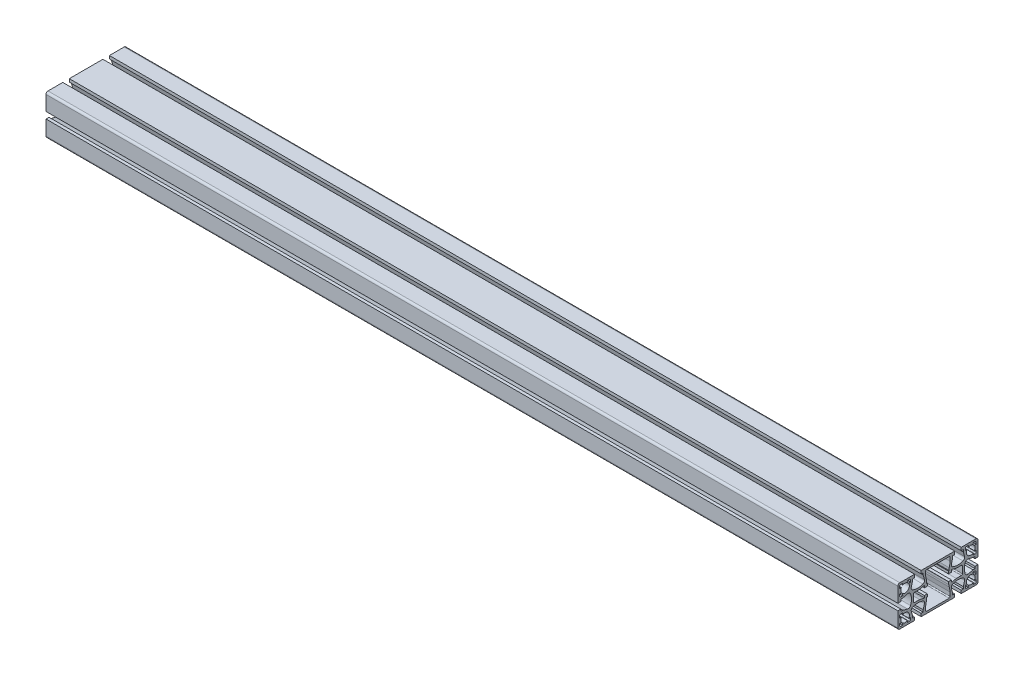
from build123d import *

# Parameters (mm, degrees)
MEMBER_1_DEPTH = 850


with BuildPart() as part:
    # Sketch11 → Member 1 (new body)
    with BuildSketch(Plane.YZ.offset(-425)):
        with BuildLine():
            Line((6.557907576, -30.305165676), (5.3, -34.999740661))
            Line((5.3, -34.999740661), (5.3, -37))
            Line((5.3, -37), (3.25, -37))
            Line((3.25, -37), (3.25, -40))
            Line((3.25, -40), (18, -40))
            ThreePointArc((18, -40), (19.414213562, -39.414213562), (20, -38))
            Line((20, -38), (20, -23.25))
            Line((20, -23.25), (17, -23.25))
            Line((17, -23.25), (17, -25.3))
            Line((17, -25.3), (14.999740661, -25.3))
            Line((14.999740661, -25.3), (10.305165676, -26.557907576))
            ThreePointArc((10.305165676, -26.557907576), (8.518070078, -26.368017861), (7.320109103, -25.028369294))
            ThreePointArc((7.320109103, -25.028369294), (6.4, -20), (7.320109103, -14.971630706))
            ThreePointArc((7.320109103, -14.971630706), (8.518070078, -13.631982139), (10.305165676, -13.442092424))
            Line((10.305165676, -13.442092424), (14.999740661, -14.7))
            Line((14.999740661, -14.7), (17, -14.7))
            Line((17, -14.7), (17, -16.75))
            Line((17, -16.75), (20, -16.75))
            Line((20, -16.75), (20, 16.75))
            Line((20, 16.75), (17, 16.75))
            Line((17, 16.75), (17, 14.7))
            Line((17, 14.7), (14.999740661, 14.7))
            Line((14.999740661, 14.7), (10.305165676, 13.442092424))
            ThreePointArc((10.305165676, 13.442092424), (8.518070078, 13.631982139), (7.320109103, 14.971630706))
            ThreePointArc((7.320109103, 14.971630706), (6.4, 20), (7.320109103, 25.028369294))
            ThreePointArc((7.320109103, 25.028369294), (8.518070078, 26.368017861), (10.305165676, 26.557907576))
            Line((10.305165676, 26.557907576), (14.999740661, 25.3))
            Line((14.999740661, 25.3), (17, 25.3))
            Line((17, 25.3), (17, 23.25))
            Line((17, 23.25), (20, 23.25))
            Line((20, 23.25), (20, 38))
            ThreePointArc((20, 38), (19.414213562, 39.414213562), (18, 40))
            Line((18, 40), (3.25, 40))
            Line((3.25, 40), (3.25, 37))
            Line((3.25, 37), (5.3, 37))
            Line((5.3, 37), (5.3, 34.999740661))
            Line((5.3, 34.999740661), (6.557907576, 30.305165676))
            ThreePointArc((6.557907576, 30.305165676), (6.368017861, 28.518070078), (5.028369294, 27.320109103))
            ThreePointArc((5.028369294, 27.320109103), (0, 26.4), (-5.028369294, 27.320109103))
            ThreePointArc((-5.028369294, 27.320109103), (-6.368017861, 28.518070078), (-6.557907576, 30.305165676))
            Line((-6.557907576, 30.305165676), (-5.3, 34.999740661))
            Line((-5.3, 34.999740661), (-5.3, 37))
            Line((-5.3, 37), (-3.25, 37))
            Line((-3.25, 37), (-3.25, 40))
            Line((-3.25, 40), (-18, 40))
            ThreePointArc((-18, 40), (-19.414213562, 39.414213562), (-20, 38))
            Line((-20, 38), (-20, 23.25))
            Line((-20, 23.25), (-17, 23.25))
            Line((-17, 23.25), (-17, 25.3))
            Line((-17, 25.3), (-14.999740661, 25.3))
            Line((-14.999740661, 25.3), (-10.305165676, 26.557907576))
            ThreePointArc((-10.305165676, 26.557907576), (-8.518070078, 26.368017861), (-7.320109103, 25.028369294))
            ThreePointArc((-7.320109103, 25.028369294), (-6.4, 20), (-7.320109103, 14.971630706))
            ThreePointArc((-7.320109103, 14.971630706), (-8.518070078, 13.631982139), (-10.305165676, 13.442092424))
            Line((-10.305165676, 13.442092424), (-14.999740661, 14.7))
            Line((-14.999740661, 14.7), (-17, 14.7))
            Line((-17, 14.7), (-17, 16.75))
            Line((-17, 16.75), (-20, 16.75))
            Line((-20, 16.75), (-20, -16.75))
            Line((-20, -16.75), (-17, -16.75))
            Line((-17, -16.75), (-17, -14.7))
            Line((-17, -14.7), (-14.999740661, -14.7))
            Line((-14.999740661, -14.7), (-10.305165676, -13.442092424))
            ThreePointArc((-10.305165676, -13.442092424), (-8.518070078, -13.631982139), (-7.320109103, -14.971630706))
            ThreePointArc((-7.320109103, -14.971630706), (-6.4, -20), (-7.320109103, -25.028369294))
            ThreePointArc((-7.320109103, -25.028369294), (-8.518070078, -26.368017861), (-10.305165676, -26.557907576))
            Line((-10.305165676, -26.557907576), (-14.999740661, -25.3))
            Line((-14.999740661, -25.3), (-17, -25.3))
            Line((-17, -25.3), (-17, -23.25))
            Line((-17, -23.25), (-20, -23.25))
            Line((-20, -23.25), (-20, -38))
            ThreePointArc((-20, -38), (-19.414213562, -39.414213562), (-18, -40))
            Line((-18, -40), (-3.25, -40))
            Line((-3.25, -40), (-3.25, -37))
            Line((-3.25, -37), (-5.3, -37))
            Line((-5.3, -37), (-5.3, -34.999740661))
            Line((-5.3, -34.999740661), (-6.557907576, -30.305165676))
            ThreePointArc((-6.557907576, -30.305165676), (-6.368017861, -28.518070078), (-5.028369294, -27.320109103))
            ThreePointArc((-5.028369294, -27.320109103), (0, -26.4), (5.028369294, -27.320109103))
            ThreePointArc((5.028369294, -27.320109103), (6.368017861, -28.518070078), (6.557907576, -30.305165676))
        make_face()
        with BuildLine():
            Line((13.3, 12.3), (17, 12.3))
            ThreePointArc((17, 12.3), (17.707106781, 12.007106781), (18, 11.3))
            Line((18, 11.3), (18, -11.3))
            ThreePointArc((18, -11.3), (17.707106781, -12.007106781), (17, -12.3))
            Line((17, -12.3), (13.3, -12.3))
            Line((13.3, -12.3), (8.3, -11.3))
            Line((8.3, -11.3), (5.8, -11.3))
            Line((5.8, -11.3), (5.8, -10.5))
            Line((5.8, -10.5), (3.4, -10.5))
            ThreePointArc((3.4, -10.5), (3.329289322, -10.529289322), (3.3, -10.6))
            Line((3.3, -10.6), (3.3, -13.5))
            Line((3.3, -13.5), (5.35, -13.5))
            Line((5.35, -13.5), (5.35, -14.5))
            Line((5.35, -14.5), (4.4, -18.286363636))
            Line((4.4, -18.286363636), (4.4, -23.4))
            ThreePointArc((4.4, -23.4), (4.107106781, -24.107106781), (3.4, -24.4))
            Line((3.4, -24.4), (-3.4, -24.4))
            ThreePointArc((-3.4, -24.4), (-4.107106781, -24.107106781), (-4.4, -23.4))
            Line((-4.4, -23.4), (-4.4, -18.286363636))
            Line((-4.4, -18.286363636), (-5.35, -14.5))
            Line((-5.35, -14.5), (-5.35, -13.5))
            Line((-5.35, -13.5), (-3.3, -13.5))
            Line((-3.3, -13.5), (-3.3, -10.6))
            ThreePointArc((-3.3, -10.6), (-3.329289322, -10.529289322), (-3.4, -10.5))
            Line((-3.4, -10.5), (-5.8, -10.5))
            Line((-5.8, -10.5), (-5.8, -11.3))
            Line((-5.8, -11.3), (-8.3, -11.3))
            Line((-8.3, -11.3), (-13.3, -12.3))
            Line((-13.3, -12.3), (-17, -12.3))
            ThreePointArc((-17, -12.3), (-17.707106781, -12.007106781), (-18, -11.3))
            Line((-18, -11.3), (-18, 11.3))
            ThreePointArc((-18, 11.3), (-17.707106781, 12.007106781), (-17, 12.3))
            Line((-17, 12.3), (-13.3, 12.3))
            Line((-13.3, 12.3), (-8.3, 11.3))
            Line((-8.3, 11.3), (-5.8, 11.3))
            Line((-5.8, 11.3), (-5.8, 10.5))
            Line((-5.8, 10.5), (-3.4, 10.5))
            ThreePointArc((-3.4, 10.5), (-3.329289322, 10.529289322), (-3.3, 10.6))
            Line((-3.3, 10.6), (-3.3, 13.5))
            Line((-3.3, 13.5), (-5.35, 13.5))
            Line((-5.35, 13.5), (-5.35, 14.5))
            Line((-5.35, 14.5), (-4.4, 18.286363636))
            Line((-4.4, 18.286363636), (-4.4, 23.4))
            ThreePointArc((-4.4, 23.4), (-4.107106781, 24.107106781), (-3.4, 24.4))
            Line((-3.4, 24.4), (3.4, 24.4))
            ThreePointArc((3.4, 24.4), (4.107106781, 24.107106781), (4.4, 23.4))
            Line((4.4, 23.4), (4.4, 18.286363636))
            Line((4.4, 18.286363636), (5.35, 14.5))
            Line((5.35, 14.5), (5.35, 13.5))
            Line((5.35, 13.5), (3.3, 13.5))
            Line((3.3, 13.5), (3.3, 10.6))
            ThreePointArc((3.3, 10.6), (3.329289322, 10.529289322), (3.4, 10.5))
            Line((3.4, 10.5), (5.8, 10.5))
            Line((5.8, 10.5), (5.8, 11.3))
            Line((5.8, 11.3), (8.3, 11.3))
            Line((8.3, 11.3), (13.3, 12.3))
        make_face(mode=Mode.SUBTRACT)
        with BuildLine():
            Line((18.136396103, -37.136396103), (18.136396103, -35.307968978))
            Line((18.136396103, -35.307968978), (17.699747468, -34.871320344))
            Line((17.699747468, -34.871320344), (16.992640687, -35.578427125))
            Line((16.992640687, -35.578427125), (16.414301398, -35.000087835))
            ThreePointArc((16.414301398, -35.000087835), (17.05, -32.75), (16.414301398, -30.499912165))
            Line((16.414301398, -30.499912165), (16.992640687, -29.921572875))
            Line((16.992640687, -29.921572875), (17.699747468, -30.628679656))
            Line((17.699747468, -30.628679656), (18.136396103, -30.192031022))
            Line((18.136396103, -30.192031022), (18.136396103, -28.363603897))
            ThreePointArc((18.136396103, -28.363603897), (17.843502884, -27.656497116), (17.136396103, -27.363603897))
            Line((17.136396103, -27.363603897), (15.307968978, -27.363603897))
            Line((15.307968978, -27.363603897), (14.871320344, -27.800252532))
            Line((14.871320344, -27.800252532), (15.578427125, -28.507359313))
            Line((15.578427125, -28.507359313), (15.000087835, -29.085698602))
            ThreePointArc((15.000087835, -29.085698602), (9.709440841, -29.709440841), (9.085698602, -35.000087835))
            Line((9.085698602, -35.000087835), (8.507359313, -35.578427125))
            Line((8.507359313, -35.578427125), (7.800252532, -34.871320344))
            Line((7.800252532, -34.871320344), (7.363603897, -35.307968978))
            Line((7.363603897, -35.307968978), (7.363603897, -37.136396103))
            ThreePointArc((7.363603897, -37.136396103), (7.656497116, -37.843502884), (8.363603897, -38.136396103))
            Line((8.363603897, -38.136396103), (10.192031022, -38.136396103))
            Line((10.192031022, -38.136396103), (10.628679656, -37.699747468))
            Line((10.628679656, -37.699747468), (9.921572875, -36.992640687))
            Line((9.921572875, -36.992640687), (10.499912165, -36.414301398))
            ThreePointArc((10.499912165, -36.414301398), (12.75, -37.05), (15.000087835, -36.414301398))
            Line((15.000087835, -36.414301398), (15.578427125, -36.992640687))
            Line((15.578427125, -36.992640687), (14.871320344, -37.699747468))
            Line((14.871320344, -37.699747468), (15.307968978, -38.136396103))
            Line((15.307968978, -38.136396103), (17.136396103, -38.136396103))
            ThreePointArc((17.136396103, -38.136396103), (17.843502884, -37.843502884), (18.136396103, -37.136396103))
        make_face(mode=Mode.SUBTRACT)
        with BuildLine():
            Line((15.307968978, 38.136396103), (17.136396103, 38.136396103))
            ThreePointArc((17.136396103, 38.136396103), (17.843502884, 37.843502884), (18.136396103, 37.136396103))
            Line((18.136396103, 37.136396103), (18.136396103, 35.307968978))
            Line((18.136396103, 35.307968978), (17.699747468, 34.871320344))
            Line((17.699747468, 34.871320344), (16.992640687, 35.578427125))
            Line((16.992640687, 35.578427125), (16.414301398, 35.000087835))
            ThreePointArc((16.414301398, 35.000087835), (17.05, 32.75), (16.414301398, 30.499912165))
            Line((16.414301398, 30.499912165), (16.992640687, 29.921572875))
            Line((16.992640687, 29.921572875), (17.699747468, 30.628679656))
            Line((17.699747468, 30.628679656), (18.136396103, 30.192031022))
            Line((18.136396103, 30.192031022), (18.136396103, 28.363603897))
            ThreePointArc((18.136396103, 28.363603897), (17.843502884, 27.656497116), (17.136396103, 27.363603897))
            Line((17.136396103, 27.363603897), (15.307968978, 27.363603897))
            Line((15.307968978, 27.363603897), (14.871320344, 27.800252532))
            Line((14.871320344, 27.800252532), (15.578427125, 28.507359313))
            Line((15.578427125, 28.507359313), (15.000087835, 29.085698602))
            ThreePointArc((15.000087835, 29.085698602), (9.709440841, 29.709440841), (9.085698602, 35.000087835))
            Line((9.085698602, 35.000087835), (8.507359313, 35.578427125))
            Line((8.507359313, 35.578427125), (7.800252532, 34.871320344))
            Line((7.800252532, 34.871320344), (7.363603897, 35.307968978))
            Line((7.363603897, 35.307968978), (7.363603897, 37.136396103))
            ThreePointArc((7.363603897, 37.136396103), (7.656497116, 37.843502884), (8.363603897, 38.136396103))
            Line((8.363603897, 38.136396103), (10.192031022, 38.136396103))
            Line((10.192031022, 38.136396103), (10.628679656, 37.699747468))
            Line((10.628679656, 37.699747468), (9.921572875, 36.992640687))
            Line((9.921572875, 36.992640687), (10.499912165, 36.414301398))
            ThreePointArc((10.499912165, 36.414301398), (12.75, 37.05), (15.000087835, 36.414301398))
            Line((15.000087835, 36.414301398), (15.578427125, 36.992640687))
            Line((15.578427125, 36.992640687), (14.871320344, 37.699747468))
            Line((14.871320344, 37.699747468), (15.307968978, 38.136396103))
        make_face(mode=Mode.SUBTRACT)
        with BuildLine():
            Line((-18.136396103, 37.136396103), (-18.136396103, 35.307968978))
            Line((-18.136396103, 35.307968978), (-17.699747468, 34.871320344))
            Line((-17.699747468, 34.871320344), (-16.992640687, 35.578427125))
            Line((-16.992640687, 35.578427125), (-16.414301398, 35.000087835))
            ThreePointArc((-16.414301398, 35.000087835), (-17.05, 32.75), (-16.414301398, 30.499912165))
            Line((-16.414301398, 30.499912165), (-16.992640687, 29.921572875))
            Line((-16.992640687, 29.921572875), (-17.699747468, 30.628679656))
            Line((-17.699747468, 30.628679656), (-18.136396103, 30.192031022))
            Line((-18.136396103, 30.192031022), (-18.136396103, 28.363603897))
            ThreePointArc((-18.136396103, 28.363603897), (-17.843502884, 27.656497116), (-17.136396103, 27.363603897))
            Line((-17.136396103, 27.363603897), (-15.307968978, 27.363603897))
            Line((-15.307968978, 27.363603897), (-14.871320344, 27.800252532))
            Line((-14.871320344, 27.800252532), (-15.578427125, 28.507359313))
            Line((-15.578427125, 28.507359313), (-15.000087835, 29.085698602))
            ThreePointArc((-15.000087835, 29.085698602), (-9.709440841, 29.709440841), (-9.085698602, 35.000087835))
            Line((-9.085698602, 35.000087835), (-8.507359313, 35.578427125))
            Line((-8.507359313, 35.578427125), (-7.800252532, 34.871320344))
            Line((-7.800252532, 34.871320344), (-7.363603897, 35.307968978))
            Line((-7.363603897, 35.307968978), (-7.363603897, 37.136396103))
            ThreePointArc((-7.363603897, 37.136396103), (-7.656497116, 37.843502884), (-8.363603897, 38.136396103))
            Line((-8.363603897, 38.136396103), (-10.192031022, 38.136396103))
            Line((-10.192031022, 38.136396103), (-10.628679656, 37.699747468))
            Line((-10.628679656, 37.699747468), (-9.921572875, 36.992640687))
            Line((-9.921572875, 36.992640687), (-10.499912165, 36.414301398))
            ThreePointArc((-10.499912165, 36.414301398), (-12.75, 37.05), (-15.000087835, 36.414301398))
            Line((-15.000087835, 36.414301398), (-15.578427125, 36.992640687))
            Line((-15.578427125, 36.992640687), (-14.871320344, 37.699747468))
            Line((-14.871320344, 37.699747468), (-15.307968978, 38.136396103))
            Line((-15.307968978, 38.136396103), (-17.136396103, 38.136396103))
            ThreePointArc((-17.136396103, 38.136396103), (-17.843502884, 37.843502884), (-18.136396103, 37.136396103))
        make_face(mode=Mode.SUBTRACT)
        with BuildLine():
            Line((-15.307968978, -38.136396103), (-17.136396103, -38.136396103))
            ThreePointArc((-17.136396103, -38.136396103), (-17.843502884, -37.843502884), (-18.136396103, -37.136396103))
            Line((-18.136396103, -37.136396103), (-18.136396103, -35.307968978))
            Line((-18.136396103, -35.307968978), (-17.699747468, -34.871320344))
            Line((-17.699747468, -34.871320344), (-16.992640687, -35.578427125))
            Line((-16.992640687, -35.578427125), (-16.414301398, -35.000087835))
            ThreePointArc((-16.414301398, -35.000087835), (-17.05, -32.75), (-16.414301398, -30.499912165))
            Line((-16.414301398, -30.499912165), (-16.992640687, -29.921572875))
            Line((-16.992640687, -29.921572875), (-17.699747468, -30.628679656))
            Line((-17.699747468, -30.628679656), (-18.136396103, -30.192031022))
            Line((-18.136396103, -30.192031022), (-18.136396103, -28.363603897))
            ThreePointArc((-18.136396103, -28.363603897), (-17.843502884, -27.656497116), (-17.136396103, -27.363603897))
            Line((-17.136396103, -27.363603897), (-15.307968978, -27.363603897))
            Line((-15.307968978, -27.363603897), (-14.871320344, -27.800252532))
            Line((-14.871320344, -27.800252532), (-15.578427125, -28.507359313))
            Line((-15.578427125, -28.507359313), (-15.000087835, -29.085698602))
            ThreePointArc((-15.000087835, -29.085698602), (-9.709440841, -29.709440841), (-9.085698602, -35.000087835))
            Line((-9.085698602, -35.000087835), (-8.507359313, -35.578427125))
            Line((-8.507359313, -35.578427125), (-7.800252532, -34.871320344))
            Line((-7.800252532, -34.871320344), (-7.363603897, -35.307968978))
            Line((-7.363603897, -35.307968978), (-7.363603897, -37.136396103))
            ThreePointArc((-7.363603897, -37.136396103), (-7.656497116, -37.843502884), (-8.363603897, -38.136396103))
            Line((-8.363603897, -38.136396103), (-10.192031022, -38.136396103))
            Line((-10.192031022, -38.136396103), (-10.628679656, -37.699747468))
            Line((-10.628679656, -37.699747468), (-9.921572875, -36.992640687))
            Line((-9.921572875, -36.992640687), (-10.499912165, -36.414301398))
            ThreePointArc((-10.499912165, -36.414301398), (-12.75, -37.05), (-15.000087835, -36.414301398))
            Line((-15.000087835, -36.414301398), (-15.578427125, -36.992640687))
            Line((-15.578427125, -36.992640687), (-14.871320344, -37.699747468))
            Line((-14.871320344, -37.699747468), (-15.307968978, -38.136396103))
        make_face(mode=Mode.SUBTRACT)
    extrude(amount=MEMBER_1_DEPTH)


solid = part.part
